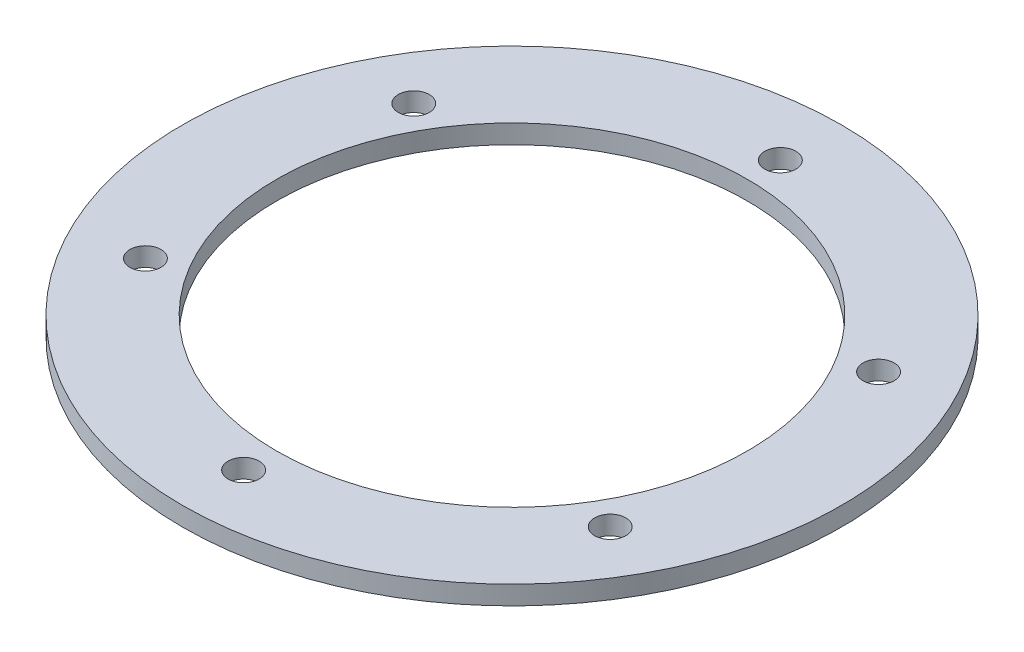
from build123d import *

# Parameters (mm, degrees)
SKETCH_1_R               = 35
EXTRUDE_1_DEPTH          = 2
SKETCH_2_R               = 25
CUT_EXTRUDE_1_DEPTH      = 2
HOLE_WIZARD_1_D          = 3.3
PATTERN_CIRCULAR_1_COUNT = 6


with BuildPart() as part:
    # 草图1 → 凸台-拉伸1 (new body)
    with BuildSketch(Plane(origin=(0, 0, 0), x_dir=(1, 0, 0), z_dir=(0, 1, 0))):
        with Locations(Location((0, 0, 0), (0, 0, 270))):
            Circle(SKETCH_1_R)
    extrude(amount=EXTRUDE_1_DEPTH)

    # 草图2 → 切除-拉伸1 (cut)
    with BuildSketch(Plane(origin=(0, 2, 0), x_dir=(1, 0, 0), z_dir=(0, 1, 0))):
        with Locations(Location((0, 0, 0), (0, 0, 270))):
            Circle(SKETCH_2_R)
    extrude(amount=-CUT_EXTRUDE_1_DEPTH, mode=Mode.SUBTRACT)

    # 孔1 (through all)
    with Locations(Plane(origin=(0, 2, 0), x_dir=(1, 0, 0), z_dir=(0, 1, 0))):
        with Locations((0, 28.5)):
            hole_wizard_1 = Hole(HOLE_WIZARD_1_D / 2)

    # 阵列(圆周)1: 孔1 ×6 about axis
    pattern_circular_1_axis = Axis((0, 0, 0), (0, 1, 0))
    for i in range(1, PATTERN_CIRCULAR_1_COUNT):
        add(hole_wizard_1.rotate(pattern_circular_1_axis, i * 360 / PATTERN_CIRCULAR_1_COUNT), mode=Mode.SUBTRACT)


solid = part.part
